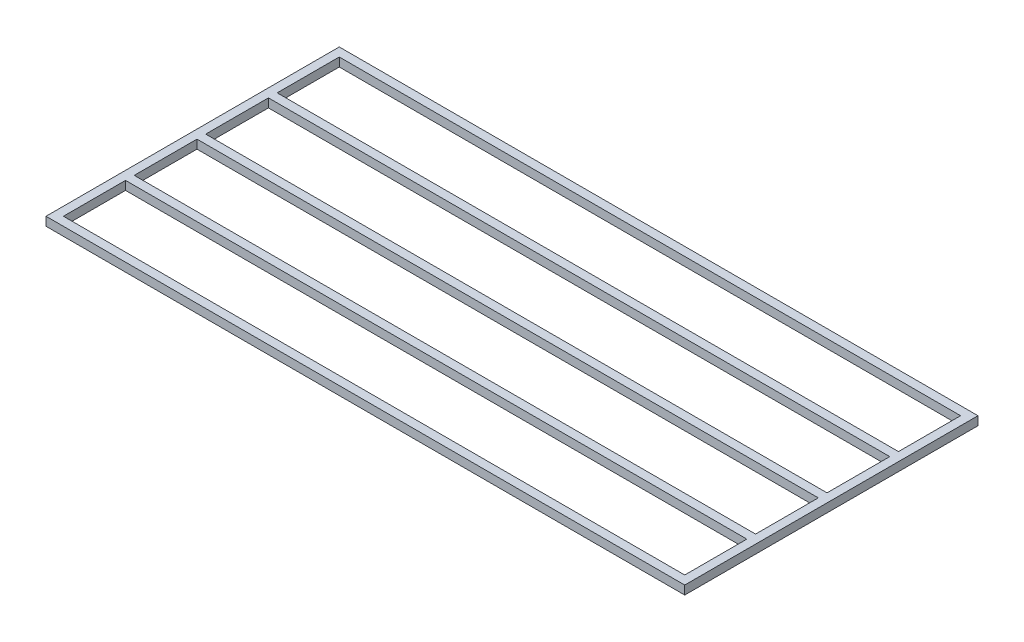
from build123d import *

# Parameters (mm, degrees)
SKETCH1_W           = 1028
SKETCH1_H           = 472
SKETCH1_W_2         = 1000
SKETCH1_H_2         = 100
SKETCH1_H_3         = 101
BOSS_EXTRUDE1_DEPTH = 14


with BuildPart() as part:
    # Sketch1 → Boss-Extrude1 (new body)
    with BuildSketch(Plane(origin=(0, 0, 0), x_dir=(1, 0, 0), z_dir=(0, 1, 0))):
        with Locations((-514, -236)):
            Rectangle(SKETCH1_W, SKETCH1_H)
        with Locations((-514, -64)):
            Rectangle(SKETCH1_W_2, SKETCH1_H_2, mode=Mode.SUBTRACT)
        with Locations((-514, -408)):
            Rectangle(SKETCH1_W_2, SKETCH1_H_2, mode=Mode.SUBTRACT)
        with Locations((-514, -178.5)):
            Rectangle(SKETCH1_W_2, SKETCH1_H_3, mode=Mode.SUBTRACT)
        with Locations((-514, -293.5)):
            Rectangle(SKETCH1_W_2, SKETCH1_H_3, mode=Mode.SUBTRACT)
    extrude(amount=BOSS_EXTRUDE1_DEPTH)


solid = part.part
